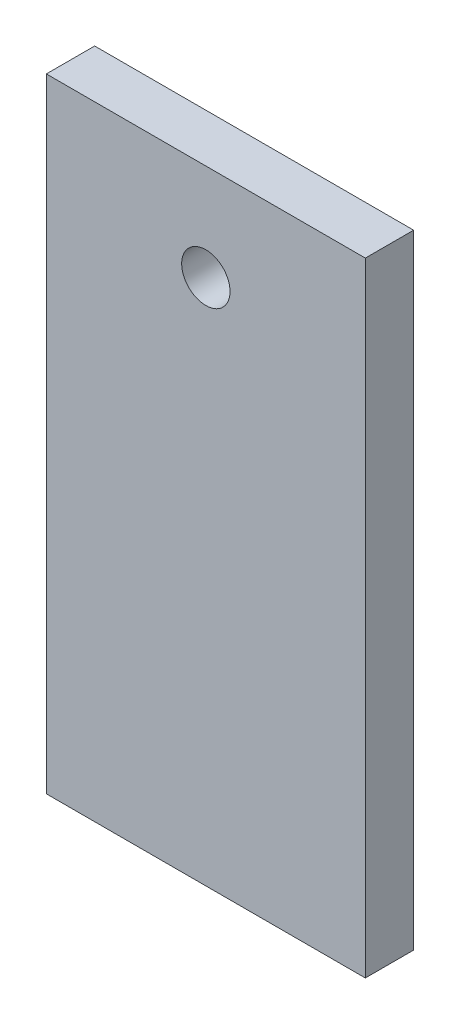
from build123d import *

# Parameters (mm, degrees)
SKETCH_1_W      = 66
SKETCH_1_H      = 129
SKETCH_1_R      = 5
EXTRUDE_1_DEPTH = 10


with BuildPart() as part:
    # 草图1 → 凸台-拉伸1 (new body)
    with BuildSketch(Plane.XY):
        with Locations((33, 64.5)):
            Rectangle(SKETCH_1_W, SKETCH_1_H)
        with Locations((33, 109)):
            Circle(SKETCH_1_R, mode=Mode.SUBTRACT)
    extrude(amount=EXTRUDE_1_DEPTH)


solid = part.part
